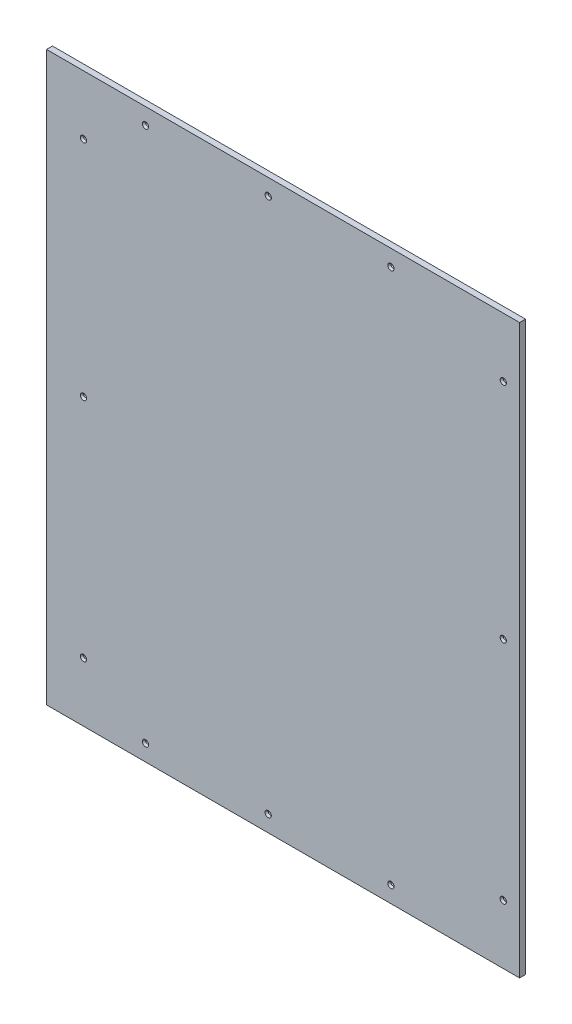
from build123d import *

# Parameters (mm, degrees)
SKETCH1_W                                           = 1016
SKETCH1_H                                           = 1219.2
BOSS_EXTRUDE1_DEPTH                                 = 12.7
SKETCH2_R                                           = 3.302
SKETCH2_R_2                                         = 3.175
CUT_EXTRUDE1_DEPTH                                  = 12.7
CSK_FOR_1_4_FLAT_HEAD_SOCKET_CAP_SCREW1_D           = 6.7564
CSK_FOR_1_4_FLAT_HEAD_SOCKET_CAP_SCREW1_CSINK_D     = 13.4874
CSK_FOR_1_4_FLAT_HEAD_SOCKET_CAP_SCREW1_CSINK_ANGLE = 82


with BuildPart() as part:
    # Sketch1 → Boss-Extrude1 (new body)
    with BuildSketch(Plane.XY):
        with Locations((-614.288814817, 609.6)):
            Rectangle(SKETCH1_W, SKETCH1_H)
    extrude(amount=BOSS_EXTRUDE1_DEPTH)

    # Sketch2 → Cut-Extrude1 (cut)
    with BuildSketch(Plane(origin=(0, 0, 0), x_dir=(-1, 0, 0), z_dir=(0, 0, -1))):
        with Locations((382.640814817, 1184.275)):
            Circle(SKETCH2_R)
        with Locations((646.165814817, 1184.275)):
            Circle(SKETCH2_R)
        with Locations((909.690814817, 1184.275)):
            Circle(SKETCH2_R)
        with Locations((1042.914014184, 1092.073)):
            Circle(SKETCH2_R_2)
        with Locations((1042.914014184, 612.775)):
            Circle(SKETCH2_R_2)
        with Locations((1042.914014184, 127)):
            Circle(SKETCH2_R_2)
        with Locations((141.213814817, 127.127)):
            Circle(SKETCH2_R_2)
        with Locations((141.213814817, 612.775)):
            Circle(SKETCH2_R)
        with Locations((141.213814817, 1092.073)):
            Circle(SKETCH2_R_2)
        with Locations(Location((909.690814817, 34.925, 0), (0, 0, 180))):
            Circle(SKETCH2_R)
        with Locations(Location((646.165814817, 34.925, 0), (0, 0, 180))):
            Circle(SKETCH2_R)
        with Locations(Location((382.640814817, 34.925, 0), (0, 0, 180))):
            Circle(SKETCH2_R)
    extrude(amount=-CUT_EXTRUDE1_DEPTH, mode=Mode.SUBTRACT)

    # CSK for 1/4 Flat Head Socket Cap Screw1 (through all)
    with Locations(Plane(origin=(-909.690814817, 1184.275, 12.7), x_dir=(1, 0, 0), z_dir=(0, 0, 1))):
        with Locations((0, 0), (263.525, 0), (527.05, 0), (768.477, -92.202), (768.477, -571.5), (768.477, -1057.148), (527.05, -1149.35), (263.525, -1149.35), (0, -1149.35), (-133.223199367, -1057.275), (-133.223199367, -571.5), (-133.223199367, -92.202)):
            CounterSinkHole(CSK_FOR_1_4_FLAT_HEAD_SOCKET_CAP_SCREW1_D / 2, CSK_FOR_1_4_FLAT_HEAD_SOCKET_CAP_SCREW1_CSINK_D / 2, counter_sink_angle=CSK_FOR_1_4_FLAT_HEAD_SOCKET_CAP_SCREW1_CSINK_ANGLE)


solid = part.part
